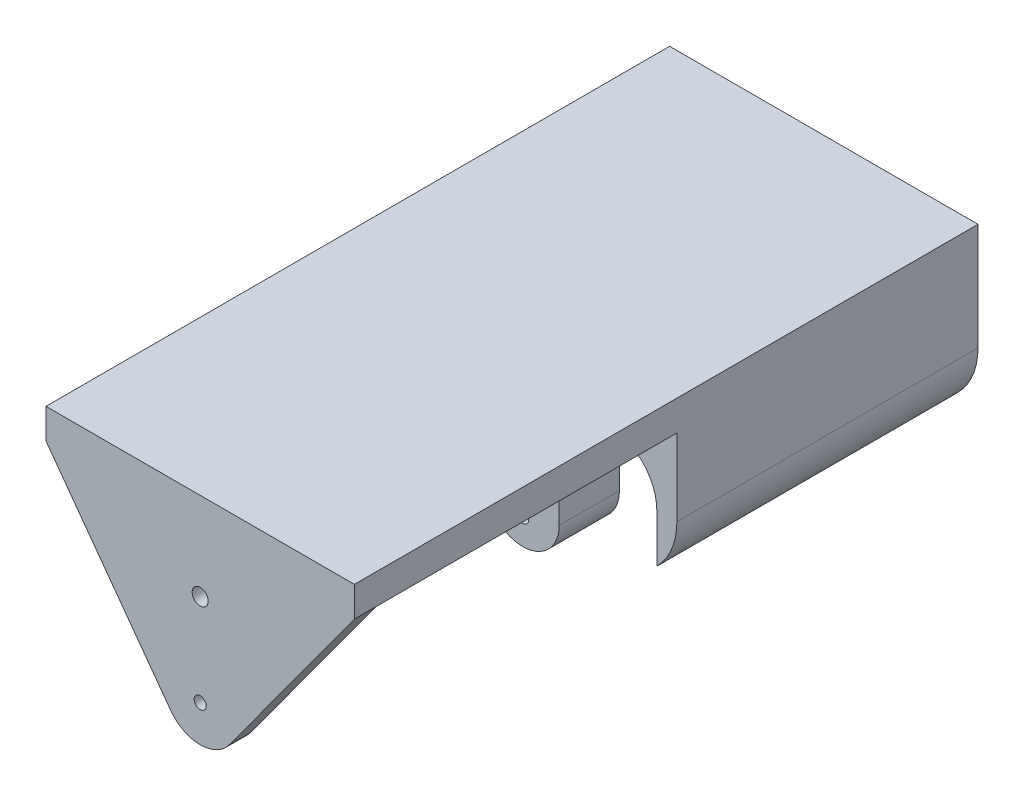
from build123d import *

# Parameters (mm, degrees)
SKETCH1_R           = 3
SKETCH1_R_2         = 8
BOSS_EXTRUDE1_DEPTH = 30
BOSS_EXTRUDE2_DEPTH = 120
SKETCH5_W           = 153.62
SKETCH5_H           = 9
SKETCH5_H_2         = 6
BOSS_EXTRUDE3_DEPTH = 150
SKETCH6_W           = 153.62
SKETCH6_H           = 6
BOSS_EXTRUDE4_DEPTH = 150
SKETCH7_W           = 153.62
SKETCH7_H           = 15
SKETCH7_R           = 18.19
BOSS_EXTRUDE5_DEPTH = 10.65
CUT_EXTRUDE1_REACH  = 337.747
SKETCH8_R           = 3
SKETCH8_R_2         = 4


with BuildPart() as part:
    # Sketch1 → Boss-Extrude1 (new body)
    with BuildSketch(Plane.XY):
        with BuildLine():
            Line((-18.19, -47.31), (-18.19, -78.22))
            ThreePointArc((-18.19, -78.22), (0, -96.41), (18.19, -78.22))
            Line((18.19, -78.22), (18.19, -47.31))
            ThreePointArc((18.19, -47.31), (42.5, -23), (66.81, -47.31))
            Line((66.81, -47.31), (66.81, -71.521567483))
            ThreePointArc((66.81, -71.521567483), (74.211608285, -60.407709723), (76.81, -47.31))
            Line((76.81, -47.31), (76.81, 0))
            Line((76.81, 0), (-76.81, 0))
            Line((-76.81, 0), (-76.81, -47.31))
            ThreePointArc((-76.81, -47.31), (-74.211608285, -60.407709723), (-66.81, -71.521567483))
            Line((-66.81, -71.521567483), (-66.81, -47.31))
            ThreePointArc((-66.81, -47.31), (-42.5, -23), (-18.19, -47.31))
        make_face()
        with Locations((0, -83.41)):
            Circle(SKETCH1_R, mode=Mode.SUBTRACT)
        with Locations((0, -37.71)):
            Circle(SKETCH1_R_2, mode=Mode.SUBTRACT)
    extrude(amount=-BOSS_EXTRUDE1_DEPTH)

    # Sketch3 → Boss-Extrude2 (add)
    with BuildSketch(Plane(origin=(0, 0, -30), x_dir=(-1, 0, 0), z_dir=(0, 0, -1))):
        with BuildLine():
            Line((-76.81, 0), (-76.81, -47.31))
            ThreePointArc((-76.81, -47.31), (-74.211608285, -60.407709723), (-66.81, -71.521567483))
            Line((-66.81, -71.521567483), (-66.81, -47.31))
            ThreePointArc((-66.81, -47.31), (-42.5, -23), (-18.19, -47.31))
            Line((-18.19, -47.31), (-18.19, -19.7))
            Line((-18.19, -19.7), (18.19, -19.7))
            Line((18.19, -19.7), (18.19, -47.31))
            ThreePointArc((18.19, -47.31), (42.5, -23), (66.81, -47.31))
            Line((66.81, -47.31), (66.81, -71.521567483))
            ThreePointArc((66.81, -71.521567483), (74.211608285, -60.407709723), (76.81, -47.31))
            Line((76.81, -47.31), (76.81, 0))
            Line((76.81, 0), (-76.81, 0))
        make_face()
    extrude(amount=BOSS_EXTRUDE2_DEPTH)

    # Sketch5 → Boss-Extrude3 (add)
    with BuildSketch(Plane.XY):
        with Locations((0, -4.5)):
            Rectangle(SKETCH5_W, SKETCH5_H)
        with Locations((0, 3)):
            Rectangle(SKETCH5_W, SKETCH5_H_2)
    extrude(amount=BOSS_EXTRUDE3_DEPTH)

    # Sketch6 → Boss-Extrude4 (add)
    with BuildSketch(Plane(origin=(0, 0, 0), x_dir=(-1, 0, 0), z_dir=(0, 0, -1))):
        with Locations((0, 3)):
            Rectangle(SKETCH6_W, SKETCH6_H)
    extrude(amount=BOSS_EXTRUDE4_DEPTH)

    # Sketch7 → Boss-Extrude5 (add)
    with BuildSketch(Plane.XY.offset(150)):
        with BuildLine():
            Line((-76.81, -9), (-14.694324823, -94.13160986))
            ThreePointArc((-14.694324823, -94.13160986), (-5.638542873, -66.115985594), (18.19, -83.41))
            ThreePointArc((18.19, -83.41), (17.294014406, -89.048542873), (14.694324823, -94.13160986))
            Line((14.694324823, -94.13160986), (76.81, -9))
            Line((76.81, -9), (-76.81, -9))
        make_face()
        with Locations((0, -1.5)):
            Rectangle(SKETCH7_W, SKETCH7_H)
        with Locations((0, -83.41)):
            Circle(SKETCH7_R)
    extrude(amount=BOSS_EXTRUDE5_DEPTH)

    # Sketch8 → Cut-Extrude1 (cut, up to next)
    with BuildSketch(Plane.XY.offset(160.65), mode=Mode.PRIVATE) as cut_extrude1_sk1:
        with Locations((0, -83.41)):
            Circle(SKETCH8_R)
    cut_extrude1_tool1 = extrude(cut_extrude1_sk1.sketch, amount=-CUT_EXTRUDE1_REACH, mode=Mode.PRIVATE) & part.part
    # Sketch8 → Cut-Extrude1 (cut, up to next)
    with BuildSketch(Plane.XY.offset(160.65), mode=Mode.PRIVATE) as cut_extrude1_sk2:
        with Locations((0, -37.71)):
            Circle(SKETCH8_R_2)
    cut_extrude1_tool2 = extrude(cut_extrude1_sk2.sketch, amount=-CUT_EXTRUDE1_REACH, mode=Mode.PRIVATE) & part.part
    add(cut_extrude1_tool1.solids().sort_by_distance((0, -83.41, 160.65))[0], mode=Mode.SUBTRACT)
    add(cut_extrude1_tool2.solids().sort_by_distance((0, -37.71, 160.65))[0], mode=Mode.SUBTRACT)


solid = part.part
